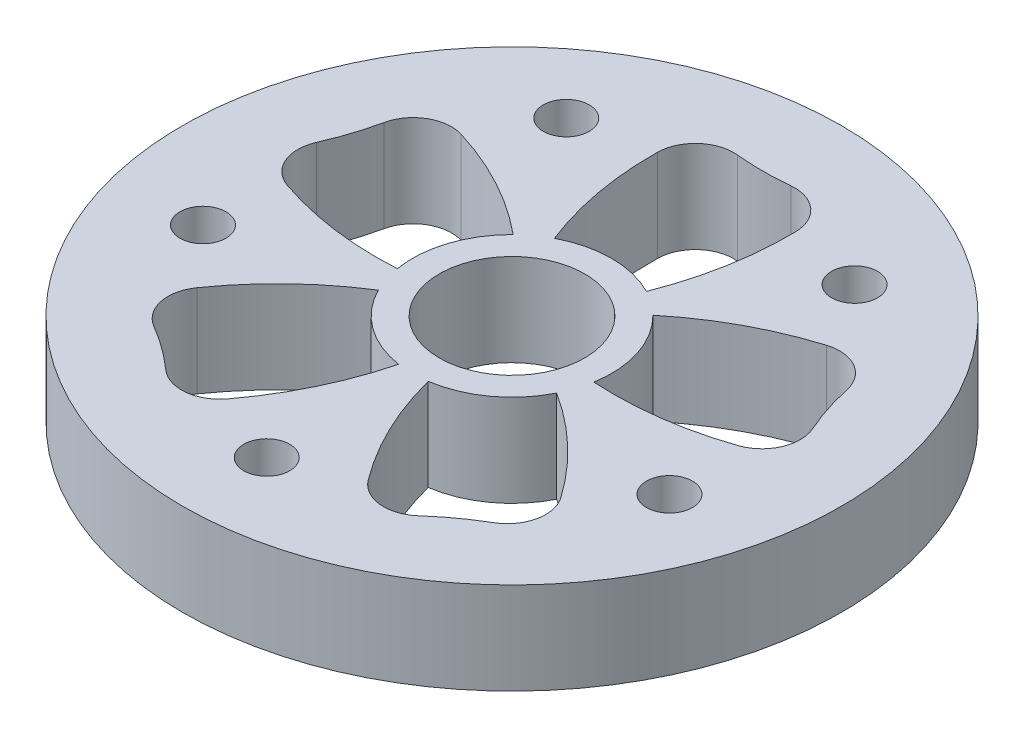
from build123d import *

# Parameters (mm, degrees)
SKETCH_1_R          = 43
SKETCH_1_R_2        = 3
EXTRUDE_1_DEPTH     = 12
SKETCH_2_R          = 9.5
CUT_EXTRUDE_1_DEPTH = 62.983868869


with BuildPart() as part:
    # 草图1 → 凸台-拉伸1 (new body)
    with BuildSketch(Plane(origin=(0, 0, 0), x_dir=(1, 0, 0), z_dir=(0, 1, 0))):
        with Locations(Location((0, 0, 0), (0, 0, 270))):
            Circle(SKETCH_1_R)
        with Locations(Location((0, -32, 0), (0, 0, 270))):
            Circle(SKETCH_1_R_2, mode=Mode.SUBTRACT)
        with Locations(Location((-30.433808521, -9.88854382, 0), (0, 0, 270))):
            Circle(SKETCH_1_R_2, mode=Mode.SUBTRACT)
        with Locations(Location((-18.809128073, 25.88854382, 0), (0, 0, 270))):
            Circle(SKETCH_1_R_2, mode=Mode.SUBTRACT)
        with Locations(Location((18.809128073, 25.88854382, 0), (0, 0, 270))):
            Circle(SKETCH_1_R_2, mode=Mode.SUBTRACT)
        with Locations(Location((30.433808521, -9.88854382, 0), (0, 0, 270))):
            Circle(SKETCH_1_R_2, mode=Mode.SUBTRACT)
    extrude(amount=EXTRUDE_1_DEPTH)

    # 草图2 → 切除-拉伸1 (cut, through all)
    with BuildSketch(Plane(origin=(0, 12, 0), x_dir=(1, 0, 0), z_dir=(0, 1, 0))):
        with Locations(Location((0, 0, 0), (0, 0, 270))):
            Circle(SKETCH_2_R)
        with BuildLine():
            ThreePointArc((6, 11.532562595), (0, 13), (-6, 11.532562595))
            ThreePointArc((-6, 11.532562595), (-8.308699922, 19.618928286), (-8.999382438, 28))
            ThreePointArc((-8.999382438, 28), (-7.324858249, 31.655760291), (-3.5, 32.896354479))
            ThreePointArc((-3.5, 32.896354479), (0, 32.720914778), (3.5, 32.896354479))
            ThreePointArc((3.5, 32.896354479), (7.324858249, 31.655760291), (8.999382438, 28))
            ThreePointArc((8.999382438, 28), (8.308699922, 19.618928286), (6, 11.532562595))
        make_face()
        with BuildLine():
            ThreePointArc((12.822220771, -2.142581267), (12.363734712, 4.017220927), (9.114016839, 9.270096928))
            ThreePointArc((9.114016839, 9.270096928), (16.091180112, 13.964625454), (23.848620344, 17.211397152))
            ThreePointArc((23.848620344, 17.211397152), (27.842911423, 16.748522069), (30.204732809, 13.494230394))
            ThreePointArc((30.204732809, 13.494230394), (31.119439219, 10.111318738), (32.36785177, 6.83683478))
            ThreePointArc((32.36785177, 6.83683478), (32.369922784, 2.815813731), (29.410544568, 0.093554533))
            ThreePointArc((29.410544568, 0.093554533), (21.226239066, -1.839460951), (12.822220771, -2.142581267))
        make_face()
        with BuildLine():
            ThreePointArc((1.924568248, -12.856750642), (7.64120828, -10.517220927), (11.632772181, -5.803327614))
            ThreePointArc((11.632772181, -5.803327614), (18.25359615, -10.988315115), (23.738640395, -17.362771566))
            ThreePointArc((23.738640395, -17.362771566), (24.532723854, -21.304604391), (22.167551497, -24.556461444))
            ThreePointArc((22.167551497, -24.556461444), (19.232871148, -26.471776127), (16.504432537, -28.67095821))
            ThreePointArc((16.504432537, -28.67095821), (12.680854244, -29.915491699), (9.177333733, -27.942180119))
            ThreePointArc((9.177333733, -27.942180119), (4.809837274, -20.755777674), (1.924568248, -12.856750642))
        make_face()
        with BuildLine():
            ThreePointArc((-11.632772181, -5.803327614), (-7.64120828, -10.517220927), (-1.924568248, -12.856750642))
            ThreePointArc((-1.924568248, -12.856750642), (-4.809837274, -20.755777674), (-9.177333733, -27.942180119))
            ThreePointArc((-9.177333733, -27.942180119), (-12.680854244, -29.915491699), (-16.504432537, -28.67095821))
            ThreePointArc((-16.504432537, -28.67095821), (-19.232871148, -26.471776127), (-22.167551497, -24.556461444))
            ThreePointArc((-22.167551497, -24.556461444), (-24.532723854, -21.304604391), (-23.738640395, -17.362771566))
            ThreePointArc((-23.738640395, -17.362771566), (-18.25359615, -10.988315115), (-11.632772181, -5.803327614))
        make_face()
        with BuildLine():
            ThreePointArc((-9.114016839, 9.270096928), (-12.363734712, 4.017220927), (-12.822220771, -2.142581267))
            ThreePointArc((-12.822220771, -2.142581267), (-21.226239066, -1.839460951), (-29.410544568, 0.093554533))
            ThreePointArc((-29.410544568, 0.093554533), (-32.369922784, 2.815813731), (-32.36785177, 6.83683478))
            ThreePointArc((-32.36785177, 6.83683478), (-31.119439219, 10.111318738), (-30.204732809, 13.494230394))
            ThreePointArc((-30.204732809, 13.494230394), (-27.842911423, 16.748522069), (-23.848620344, 17.211397152))
            ThreePointArc((-23.848620344, 17.211397152), (-16.091180112, 13.964625454), (-9.114016839, 9.270096928))
        make_face()
    extrude(amount=-CUT_EXTRUDE_1_DEPTH, mode=Mode.SUBTRACT)


solid = part.part
